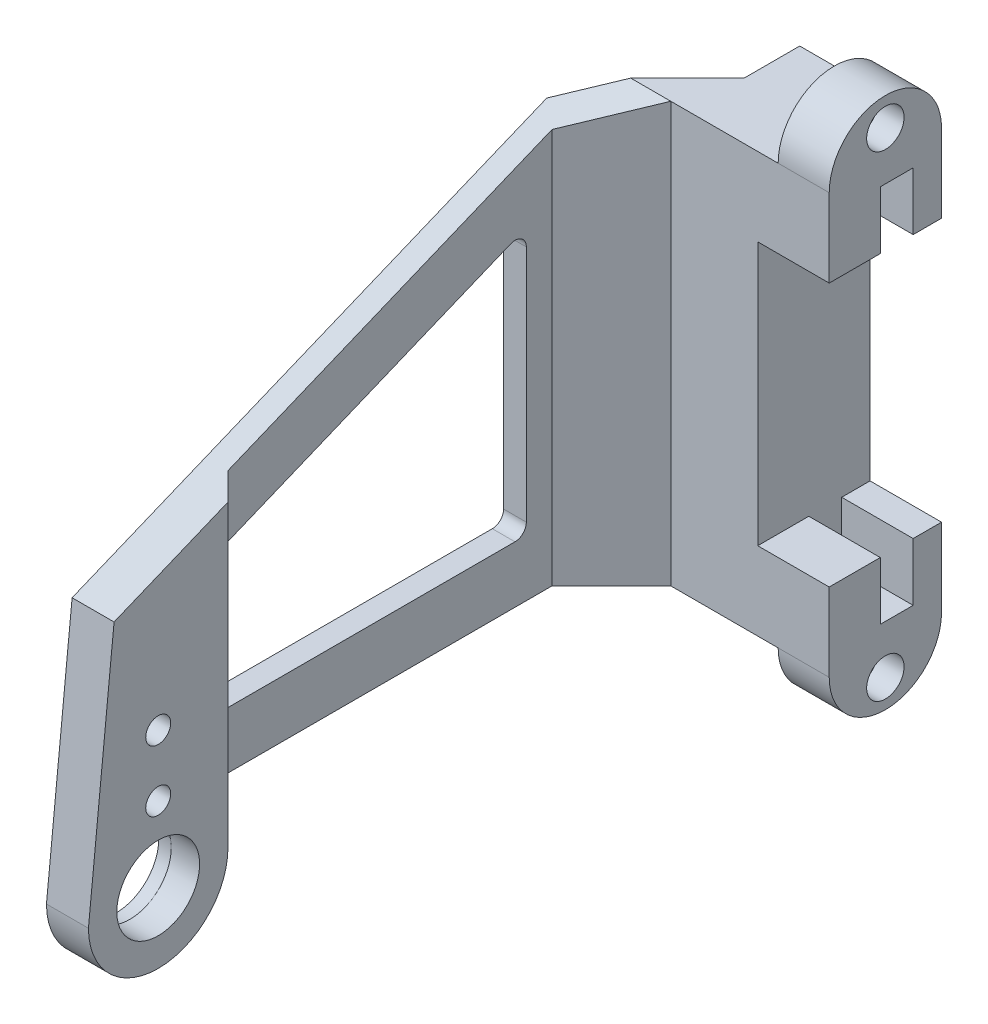
from build123d import *

# Parameters (mm, degrees)
SZKIC1_W                    = 12.5
SZKIC1_H                    = 37
DODANIE_WYCI_GNI_CIE1_DEPTH = 9.9
SZKIC2_W                    = 6.3
SZKIC2_H                    = 23.2
WYTNIJ_WYCI_GNI_CIE1_DEPTH  = 9.9
SZKIC3_R                    = 2
SZKIC3_R_2                  = 3.65
DODANIE_WYCI_GNI_CIE2_DEPTH = 7.5
WYTNIJ_WYCI_GNI_CIE2_DEPTH  = 78.151879433
WYTNIJ_WYCI_GNI_CIE3_DEPTH  = 72.402310887
ESQUISSE2_W                 = 2.9
ESQUISSE2_H                 = 5.1
ENL_V_MAT_EXTRU_1_DEPTH     = 6.3
BOSS_EXTRU_2_START          = -2.5
ESQUISSE5_R                 = 3.65
BOSS_EXTRU_2_DEPTH          = 2.5
BOSS_EXTRU_3_DEPTH          = 37
ESQUISSE7_R                 = 1.1
BOSS_EXTRU_4_DEPTH          = 4.5
ESQUISSE8_R                 = 1.65
ESQUISSE8_R_2               = 1.1
ENL_V_MAT_EXTRU_2_DEPTH     = 2.3
BOSS_EXTRU_7_START          = 1.2
BOSS_EXTRU_7_DEPTH          = 1.2
ENL_V_MAT_EXTRU_3_DEPTH     = 75.421317511
ENL_V_MAT_EXTRU_4_DEPTH     = 75.088410025


with BuildPart() as part:
    # Szkic1 → Dodanie-wyciągnięcie1 (new body)
    with BuildSketch(Plane.XY):
        with Locations((-6.25, 18.5)):
            Rectangle(SZKIC1_W, SZKIC1_H)
    extrude(amount=DODANIE_WYCI_GNI_CIE1_DEPTH)

    # Szkic2 → Wytnij-wyciągnięcie1 (cut)
    with BuildSketch(Plane.XY.offset(9.9)):
        with Locations((-3.15, 18.5)):
            Rectangle(SZKIC2_W, SZKIC2_H)
    extrude(amount=-WYTNIJ_WYCI_GNI_CIE1_DEPTH, mode=Mode.SUBTRACT)

    # Szkic3 → Dodanie-wyciągnięcie2 (add)
    with BuildSketch(Plane.ZY.offset(12.5)):
        with BuildLine():
            Line((55.440769231, 18.25), (57.7, -4))
            ThreePointArc((57.7, -4), (51.55, -10.15), (45.4, -4))
            Line((45.4, -4), (45.4, 0))
            Line((45.4, 0), (7.4, 0))
            Line((7.4, 0), (7.4, 37))
            Line((7.4, 37), (9.9, 37))
            Line((9.9, 37), (55.440769231, 18.25))
        make_face()
        with Locations((51.55, 12.25)):
            Circle(SZKIC3_R, mode=Mode.SUBTRACT)
        with Locations((51.55, -4)):
            Circle(SZKIC3_R_2, mode=Mode.SUBTRACT)
    extrude(amount=DODANIE_WYCI_GNI_CIE2_DEPTH)

    # Szkic4 → Wytnij-wyciągnięcie2 (cut, through all)
    with BuildSketch(Plane(origin=(0, 37, 0), x_dir=(1, 0, 0), z_dir=(0, 1, 0))):
        Polygon((-17.5, -9.9), (-15, -7.4), (-20, -7.4), (-20, -9.9), align=None)
        Polygon((-20, -12.4), (-17.5, -9.9), (-20, -9.9), align=None)
        Polygon((-12.5, -9.9), (-13.964466094, -9.9), (-17.5, -13.435533906), (-17.5, -57.7), (-12.5, -57.7), (-12.5, -55.440769231), align=None)
    extrude(amount=-WYTNIJ_WYCI_GNI_CIE2_DEPTH, mode=Mode.SUBTRACT)

    # Szkic5 → Wytnij-wyciągnięcie3 (cut, through all)
    with BuildSketch(Plane.ZY.offset(20)):
        with BuildLine():
            Line((45.4, 16.307054303), (45.4, 6))
            ThreePointArc((45.4, 6), (45.107106781, 5.292893219), (44.4, 5))
            Line((44.4, 5), (18.4, 5))
            ThreePointArc((18.4, 5), (17.692893219, 5.292893219), (17.4, 6))
            Line((17.4, 6), (17.4, 27.011748322))
            ThreePointArc((17.4, 27.011748322), (17.843544103, 27.842625469), (18.780713669, 27.936441299))
            Line((18.780713669, 27.936441299), (44.780713669, 17.23174728))
            ThreePointArc((44.780713669, 17.23174728), (45.230877148, 16.8635102), (45.4, 16.307054303))
        make_face()
    extrude(amount=-WYTNIJ_WYCI_GNI_CIE3_DEPTH, mode=Mode.SUBTRACT)

    # Esquisse2 → Enlèv. mat.-Extru.1 (cut)
    with BuildSketch(Plane(origin=(0, 0, 0), x_dir=(0, 0, -1), z_dir=(1, 0, 0))):
        with Locations((-3.95, 32.65)):
            Rectangle(ESQUISSE2_W, ESQUISSE2_H)
        with Locations((-3.95, 4.35)):
            Rectangle(ESQUISSE2_W, ESQUISSE2_H)
    extrude(amount=-ENL_V_MAT_EXTRU_1_DEPTH, mode=Mode.SUBTRACT)

    # Esquisse5 → Boss.-Extru.2 (add)
    with BuildSketch(Plane(origin=(-17.5, 0, 0), x_dir=(0, 0, -1), z_dir=(1, 0, 0)).offset(BOSS_EXTRU_2_START)):
        with BuildLine():
            Line((-13.435533906, 0), (-13.435533906, 35.544353513))
            Line((-13.435533906, 35.544353513), (-55.440769231, 18.25))
            Line((-55.440769231, 18.25), (-57.7, -4))
            ThreePointArc((-57.7, -4), (-51.55, -10.15), (-45.4, -4))
            Line((-45.4, -4), (-45.4, 0))
            Line((-45.4, 0), (-13.435533906, 0))
        make_face()
        with Locations(Location((-51.55, -4, 0), (0, 0, 180))):
            Circle(ESQUISSE5_R, mode=Mode.SUBTRACT)
        with BuildLine():
            Line((-17.4, 6), (-17.4, 27.011748322))
            ThreePointArc((-17.4, 27.011748322), (-17.843544103, 27.842625469), (-18.780713669, 27.936441299))
            Line((-18.780713669, 27.936441299), (-44.780713669, 17.23174728))
            ThreePointArc((-44.780713669, 17.23174728), (-45.230877148, 16.8635102), (-45.4, 16.307054303))
            Line((-45.4, 16.307054303), (-45.4, 6))
            ThreePointArc((-45.4, 6), (-45.107106781, 5.292893219), (-44.4, 5))
            Line((-44.4, 5), (-18.4, 5))
            ThreePointArc((-18.4, 5), (-17.692893219, 5.292893219), (-17.4, 6))
        make_face(mode=Mode.SUBTRACT)
    extrude(amount=BOSS_EXTRU_2_DEPTH)

    # Esquisse6 → Boss.-Extru.3 (add)
    with BuildSketch(Plane(origin=(0, 37, 0), x_dir=(1, 0, 0), z_dir=(0, 1, 0))):
        Polygon((-12.5, -4.9), (-15, -7.4), (-12.5, -7.4), align=None)
    extrude(amount=-BOSS_EXTRU_3_DEPTH)

    # Esquisse7 → Boss.-Extru.4 (add)
    # profile 1 of 2: a face of its own
    with BuildSketch(Plane(origin=(0, 0, 0), x_dir=(0, 0, -1), z_dir=(1, 0, 0))):
        with BuildLine():
            Line((-9.9, 37), (0, 37))
            ThreePointArc((0, 37), (-4.95, 41.95), (-9.9, 37))
        make_face()
        with Locations(Location((-4.95, 39.475, 0), (0, 0, 90))):
            Circle(ESQUISSE7_R, mode=Mode.SUBTRACT)
    # profile 2 of 2: a face of its own
    with BuildSketch(Plane(origin=(0, 0, 0), x_dir=(0, 0, -1), z_dir=(1, 0, 0))):
        with BuildLine():
            Line((-9.9, 0), (0, 0))
            ThreePointArc((0, 0), (-4.95, -4.95), (-9.9, 0))
        make_face()
        with Locations(Location((-4.95, -2.475, 0), (0, 0, 270))):
            Circle(ESQUISSE7_R, mode=Mode.SUBTRACT)
    extrude(amount=-BOSS_EXTRU_4_DEPTH)

    # Esquisse8 → Enlèv. mat.-Extru.2 (cut)
    # profile 1 of 2: a face of its own
    with BuildSketch(Plane(origin=(0, 0, 0), x_dir=(0, 0, -1), z_dir=(1, 0, 0))):
        with Locations(Location((-4.95, 39.475, 0), (0, 0, 90))):
            Circle(ESQUISSE8_R)
        with Locations(Location((-4.95, 39.475, 0), (0, 0, 90))):
            Circle(ESQUISSE8_R_2, mode=Mode.SUBTRACT)
    # profile 2 of 2: a face of its own
    with BuildSketch(Plane(origin=(0, 0, 0), x_dir=(0, 0, -1), z_dir=(1, 0, 0))):
        with Locations(Location((-4.95, -2.475, 0), (0, 0, 90))):
            Circle(ESQUISSE8_R)
        with Locations(Location((-4.95, -2.475, 0), (0, 0, 90))):
            Circle(ESQUISSE8_R_2, mode=Mode.SUBTRACT)
    extrude(amount=-ENL_V_MAT_EXTRU_2_DEPTH, mode=Mode.SUBTRACT)

    # Esquisse9 → Boss.-Extru.7 (add)
    with BuildSketch(Plane.ZY.offset(20).offset(BOSS_EXTRU_7_START)):
        with BuildLine():
            Line((12.4, 35.970702498), (12.4, 0))
            Line((12.4, 0), (45.4, 0))
            Line((45.4, 0), (45.4, -4))
            ThreePointArc((45.4, -4), (51.55, -10.15), (57.7, -4))
            Line((57.7, -4), (55.440769231, 18.25))
            Line((55.440769231, 18.25), (12.4, 35.970702498))
        make_face()
        with BuildLine():
            Line((47.863295083, -3.313919205), (49.350089671, 12.369863153))
            ThreePointArc((49.350089671, 12.369863153), (51.55, 14.55), (53.749910329, 12.369863153))
            Line((53.749910329, 12.369863153), (55.236704917, -3.313919205))
            ThreePointArc((55.236704917, -3.313919205), (51.55, -7.75), (47.863295083, -3.313919205))
        make_face(mode=Mode.SUBTRACT)
        with BuildLine():
            Line((18.780713669, 27.936441299), (44.780713669, 17.23174728))
            ThreePointArc((44.780713669, 17.23174728), (45.230877148, 16.8635102), (45.4, 16.307054303))
            Line((45.4, 16.307054303), (45.4, 6))
            ThreePointArc((45.4, 6), (45.107106781, 5.292893219), (44.4, 5))
            Line((44.4, 5), (18.4, 5))
            ThreePointArc((18.4, 5), (17.692893219, 5.292893219), (17.4, 6))
            Line((17.4, 6), (17.4, 27.011748322))
            ThreePointArc((17.4, 27.011748322), (17.843544103, 27.842625469), (18.780713669, 27.936441299))
        make_face(mode=Mode.SUBTRACT)
    extrude(amount=-BOSS_EXTRU_7_DEPTH)

    # Esquisse10 → Enlèv. mat.-Extru.3 (cut, through all)
    with BuildSketch(Plane.XZ):
        Polygon((-19.2, 43.7), (-19.2, 15.135533906), (-17.5, 13.435533906), (-17.5, 45.4), align=None)
        Polygon((-21.2, 12.4), (-20, 12.4), (-21.2, 13.6), align=None)
    extrude(amount=-ENL_V_MAT_EXTRU_3_DEPTH, mode=Mode.SUBTRACT)

    # Esquisse11 → Enlèv. mat.-Extru.4 (cut, through all)
    with BuildSketch(Plane.ZY.offset(20)):
        with BuildLine():
            ThreePointArc((52.05, 8.05), (51.903553391, 8.403553391), (51.55, 8.55))
            Line((51.55, 8.55), (51.55, 7.55))
            ThreePointArc((51.55, 7.55), (51.903553391, 7.696446609), (52.05, 8.05))
        make_face()
        with BuildLine():
            Line((51.55, 7.55), (51.55, 8.55))
            ThreePointArc((51.55, 8.55), (51.05, 8.05), (51.55, 7.55))
        make_face()
        with BuildLine():
            ThreePointArc((52.65, 8.05), (52.327817459, 8.827817459), (51.55, 9.15))
            Line((51.55, 9.15), (51.55, 8.55))
            ThreePointArc((51.55, 8.55), (51.903553391, 8.403553391), (52.05, 8.05))
            ThreePointArc((52.05, 8.05), (51.903553391, 7.696446609), (51.55, 7.55))
            Line((51.55, 7.55), (51.55, 6.95))
            ThreePointArc((51.55, 6.95), (52.327817459, 7.272182541), (52.65, 8.05))
        make_face()
        with BuildLine():
            Line((51.55, 8.55), (51.55, 9.15))
            ThreePointArc((51.55, 9.15), (50.45, 8.05), (51.55, 6.95))
            Line((51.55, 6.95), (51.55, 7.55))
            ThreePointArc((51.55, 7.55), (51.05, 8.05), (51.55, 8.55))
        make_face()
        with BuildLine():
            ThreePointArc((51.55, 3.75), (50.45, 2.65), (51.55, 1.55))
            Line((51.55, 1.55), (51.55, 2.15))
            ThreePointArc((51.55, 2.15), (51.05, 2.65), (51.55, 3.15))
            Line((51.55, 3.15), (51.55, 3.75))
        make_face()
        with BuildLine():
            Line((51.55, 2.15), (51.55, 1.55))
            ThreePointArc((51.55, 1.55), (52.327817459, 1.872182541), (52.65, 2.65))
            ThreePointArc((52.65, 2.65), (52.327817459, 3.427817459), (51.55, 3.75))
            Line((51.55, 3.75), (51.55, 3.15))
            ThreePointArc((51.55, 3.15), (51.903553391, 3.003553391), (52.05, 2.65))
            ThreePointArc((52.05, 2.65), (51.903553391, 2.296446609), (51.55, 2.15))
        make_face()
        with BuildLine():
            ThreePointArc((51.55, 3.15), (51.05, 2.65), (51.55, 2.15))
            Line((51.55, 2.15), (51.55, 3.15))
        make_face()
        with BuildLine():
            Line((51.55, 3.15), (51.55, 2.15))
            ThreePointArc((51.55, 2.15), (51.903553391, 2.296446609), (52.05, 2.65))
            ThreePointArc((52.05, 2.65), (51.903553391, 3.003553391), (51.55, 3.15))
        make_face()
    extrude(amount=-ENL_V_MAT_EXTRU_4_DEPTH, mode=Mode.SUBTRACT)


solid = part.part
